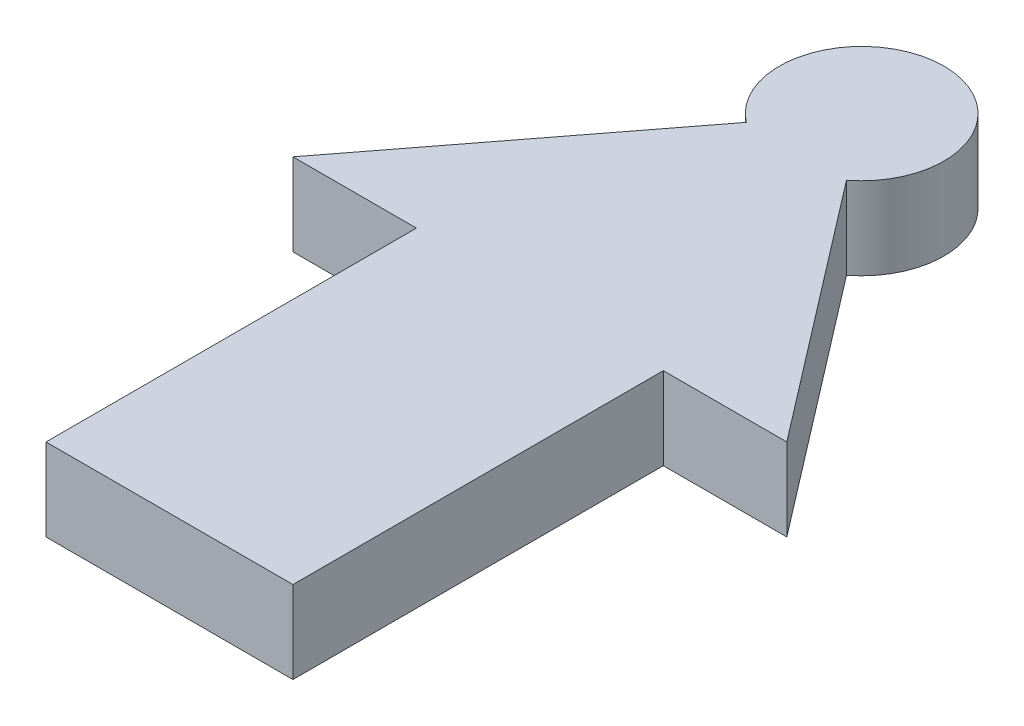
from build123d import *

# Parameters (mm, degrees)
SKETCH1_W           = 76.2
SKETCH1_H           = 114.3
BOSS_EXTRUDE1_DEPTH = 25.4


with BuildPart() as part:
    # Sketch1 → Boss-Extrude1 (new body)
    with BuildSketch(Plane(origin=(0, 0, 0), x_dir=(1, 0, 0), z_dir=(0, 1, 0))):
        Polygon((-76.2, 57.15), (76.2, 57.15), (0, 156.455773411), align=None)
        Rectangle(SKETCH1_W, SKETCH1_H)
        with BuildLine():
            ThreePointArc((25.4, 156.455773411), (-11.234132732, 179.236341045), (-15.462540297, 136.304598567))
            Line((-15.462540297, 136.304598567), (0, 156.455773411))
            Line((0, 156.455773411), (15.462540297, 136.304598567))
            ThreePointArc((15.462540297, 136.304598567), (22.780567635, 145.221640679), (25.4, 156.455773411))
        make_face()
        with BuildLine():
            Line((0, 156.455773411), (-15.462540297, 136.304598567))
            ThreePointArc((-15.462540297, 136.304598567), (0, 131.055773411), (15.462540297, 136.304598567))
            Line((15.462540297, 136.304598567), (0, 156.455773411))
        make_face()
    extrude(amount=BOSS_EXTRUDE1_DEPTH)


solid = part.part
